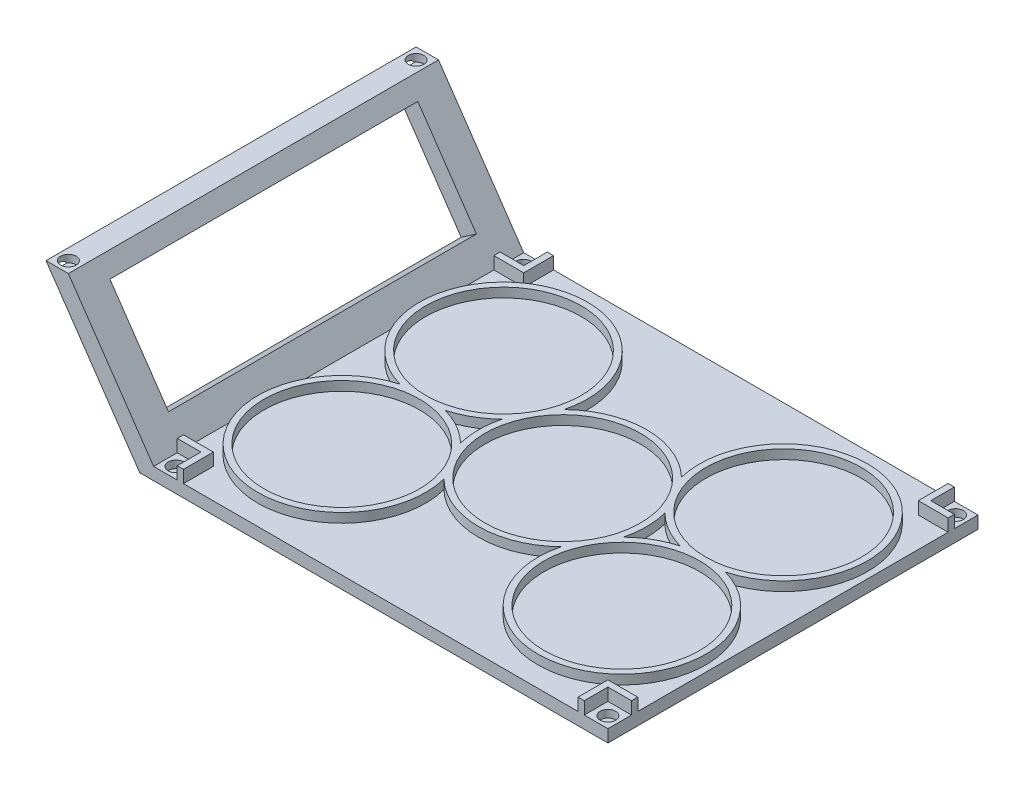
from build123d import *

# Parameters (mm, degrees)
SKETCH1_W           = 73.033321
SKETCH1_H           = 59.5
BOSS_EXTRUDE1_DEPTH = 2
SKETCH2_R           = 13.5
SKETCH2_R_2         = 12.5
BOSS_EXTRUDE2_DEPTH = 1.5
SKETCH3_R           = 1.25
CUT_EXTRUDE1_DEPTH  = 1.2
BOSS_EXTRUDE3_DEPTH = 59.5
SKETCH5_R           = 1.25
CUT_EXTRUDE2_DEPTH  = 1.2
SKETCH7_W           = 49.5
SKETCH7_H           = 16.666550208
CUT_EXTRUDE4_DEPTH  = 3.6
BOSS_EXTRUDE4_DEPTH = 2


with BuildPart() as part:
    # Sketch1 → Boss-Extrude1 (new body)
    with BuildSketch(Plane(origin=(0, 0, 0), x_dir=(1, 0, 0), z_dir=(0, 1, 0))):
        with Locations((-151.204244356, -15.021595707)):
            Rectangle(SKETCH1_W, SKETCH1_H)
    extrude(amount=BOSS_EXTRUDE1_DEPTH)

    # Sketch2 → Boss-Extrude2 (add)
    # profile 1 of 5: a face of its own
    with BuildSketch(Plane(origin=(0, 2, 0), x_dir=(1, 0, 0), z_dir=(0, 1, 0))):
        with Locations((-129.187583856, -28.021595707)):
            Circle(SKETCH2_R)
        with Locations(Location((-129.187583856, -28.021595707, 0), (0, 0, 270))):
            Circle(SKETCH2_R_2, mode=Mode.SUBTRACT)
    # profile 2 of 5: a face of its own
    with BuildSketch(Plane(origin=(0, 2, 0), x_dir=(1, 0, 0), z_dir=(0, 1, 0))):
        with Locations((-129.187583856, -2.021595707)):
            Circle(SKETCH2_R)
        with Locations(Location((-129.187583856, -2.021595707, 0), (0, 0, 270))):
            Circle(SKETCH2_R_2, mode=Mode.SUBTRACT)
    # profile 3 of 5: a face of its own
    with BuildSketch(Plane(origin=(0, 2, 0), x_dir=(1, 0, 0), z_dir=(0, 1, 0))):
        with Locations((-151.704244355, -15.021595707)):
            Circle(SKETCH2_R)
        with Locations(Location((-151.704244355, -15.021595707, 0), (0, 0, 270))):
            Circle(SKETCH2_R_2, mode=Mode.SUBTRACT)
    # profile 4 of 5: a face of its own
    with BuildSketch(Plane(origin=(0, 2, 0), x_dir=(1, 0, 0), z_dir=(0, 1, 0))):
        with Locations((-174.220904853, -2.021595707)):
            Circle(SKETCH2_R)
        with Locations(Location((-174.220904853, -2.021595707, 0), (0, 0, 270))):
            Circle(SKETCH2_R_2, mode=Mode.SUBTRACT)
    # profile 5 of 5: a face of its own
    with BuildSketch(Plane(origin=(0, 2, 0), x_dir=(1, 0, 0), z_dir=(0, 1, 0))):
        with Locations((-174.220904853, -28.021595707)):
            Circle(SKETCH2_R)
        with Locations(Location((-174.220904853, -28.021595707, 0), (0, 0, 270))):
            Circle(SKETCH2_R_2, mode=Mode.SUBTRACT)
    extrude(amount=BOSS_EXTRUDE2_DEPTH)

    # Sketch3 → Cut-Extrude1 (cut)
    with BuildSketch(Plane(origin=(0, 2, 0), x_dir=(1, 0, 0), z_dir=(0, 1, 0))):
        with Locations(Location((-185.920904856, 12.928404293, 0), (0, 0, 270))):
            Circle(SKETCH3_R)
        with Locations(Location((-185.920904856, -42.971595707, 0), (0, 0, 270))):
            Circle(SKETCH3_R)
        with Locations(Location((-116.487583856, -42.971595707, 0), (0, 0, 270))):
            Circle(SKETCH3_R)
        with Locations(Location((-116.487583856, 12.928404293, 0), (0, 0, 270))):
            Circle(SKETCH3_R)
    extrude(amount=-CUT_EXTRUDE1_DEPTH, mode=Mode.SUBTRACT)

    # Sketch4 → Boss-Extrude3 (add)
    with BuildSketch(Plane.XY.offset(44.771595707)):
        Polygon((-201.420904856, 22), (-187.720904856, 2), (-187.720904856, 0), (-189.950904856, 0), (-191.320904856, 2), (-205.020904856, 22), align=None)
    extrude(amount=-BOSS_EXTRUDE3_DEPTH)

    # Sketch5 → Cut-Extrude2 (cut)
    with BuildSketch(Plane(origin=(0, 22, 0), x_dir=(1, 0, 0), z_dir=(0, 1, 0))):
        with Locations(Location((-203.220904856, 12.928404293, 0), (0, 0, 180))):
            Circle(SKETCH5_R)
        with Locations(Location((-203.220904856, -42.971595707, 0), (0, 0, 180))):
            Circle(SKETCH5_R)
    extrude(amount=-CUT_EXTRUDE2_DEPTH, mode=Mode.SUBTRACT)

    # Sketch7 → Cut-Extrude4 (cut)
    with BuildSketch(Plane(origin=(-129.286463854, -88.56122774, 0), x_dir=(0, 0, 1), z_dir=(-0.8250036029532889, -0.5651274680230048, 0))):
        with Locations((15.021595707, 120.679749014)):
            Rectangle(SKETCH7_W, SKETCH7_H)
    extrude(amount=-CUT_EXTRUDE4_DEPTH, mode=Mode.SUBTRACT)

    # Sketch8 → Boss-Extrude4 (add)
    with BuildSketch(Plane(origin=(0, 2, 0), x_dir=(1, 0, 0), z_dir=(0, 1, 0))):
        Polygon((-182.920904856, 9.928404293), (-182.920904856, 14.728404293), (-183.920904856, 14.728404293), (-183.920904856, 10.928404293), (-187.720904856, 10.928404293), (-187.720904856, 9.928404293), align=None)
        Polygon((-183.920904856, -40.971595707), (-183.920904856, -44.771595707), (-182.920904856, -44.771595707), (-182.920904856, -39.971595707), (-187.720904856, -39.971595707), (-187.720904856, -40.971595707), align=None)
        Polygon((-119.487583856, -39.971595707), (-119.487583856, -44.771595707), (-118.487583856, -44.771595707), (-118.487583856, -40.971595707), (-114.687583856, -40.971595707), (-114.687583856, -39.971595707), align=None)
        Polygon((-119.487583856, 9.928404293), (-114.687583856, 9.928404293), (-114.687583856, 10.928404293), (-118.487583856, 10.928404293), (-118.487583856, 14.728404293), (-119.487583856, 14.728404293), align=None)
    extrude(amount=BOSS_EXTRUDE4_DEPTH)


solid = part.part
